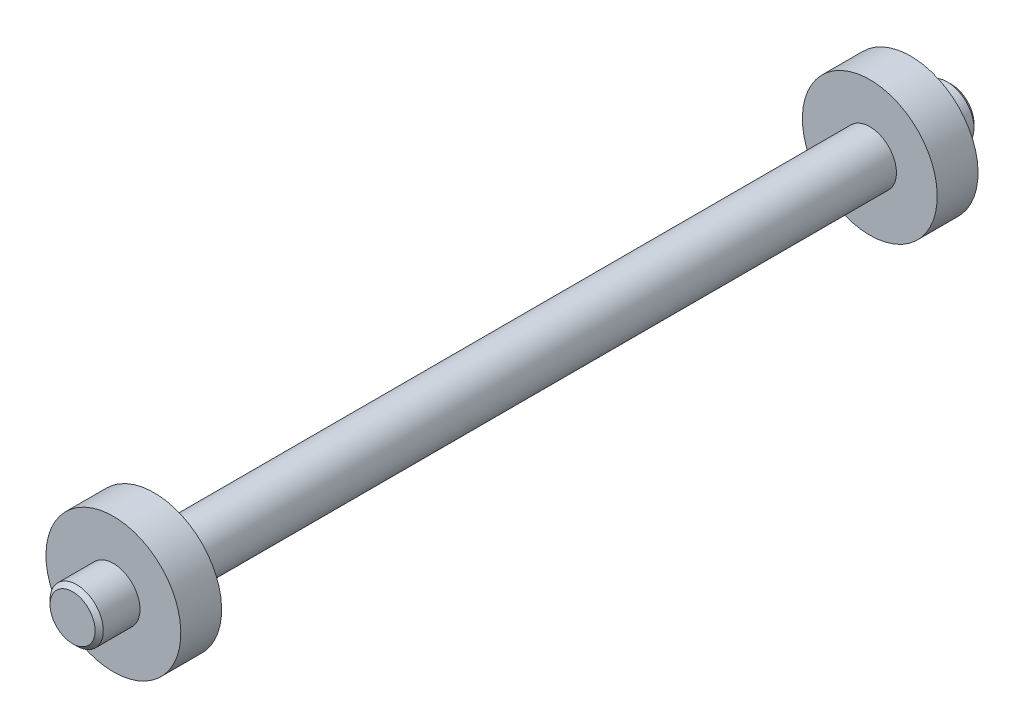
from build123d import *

# Parameters (mm, degrees)
CHAMFER_1_SIZE = 0.1625


with BuildPart() as part:
    # 草图2 → 旋转1 (revolve)
    with BuildSketch(Plane(origin=(0, 0, 0), x_dir=(0, 0, -1), z_dir=(1, 0, 0))):
        Polygon((-17.5, 0), (17.5, 0), (17.5, 1.06), (15.875, 1.06), (15.875, 2.685), (14.25, 2.685), (14.25, 1.06), (-14.25, 1.06), (-14.25, 2.685), (-15.875, 2.685), (-15.875, 1.06), (-17.5, 1.06), align=None)
    revolve(axis=Axis((0, 0, 17.5), (0, 0, -1)))

    # 倒角1
    chamfer_1_edges = [part.edges().sort_by_distance(p)[0] for p in [
        (0, -1.06, -17.5),
        (0, -1.06, 17.5),
    ]]
    chamfer(chamfer_1_edges, length=CHAMFER_1_SIZE)


solid = part.part
